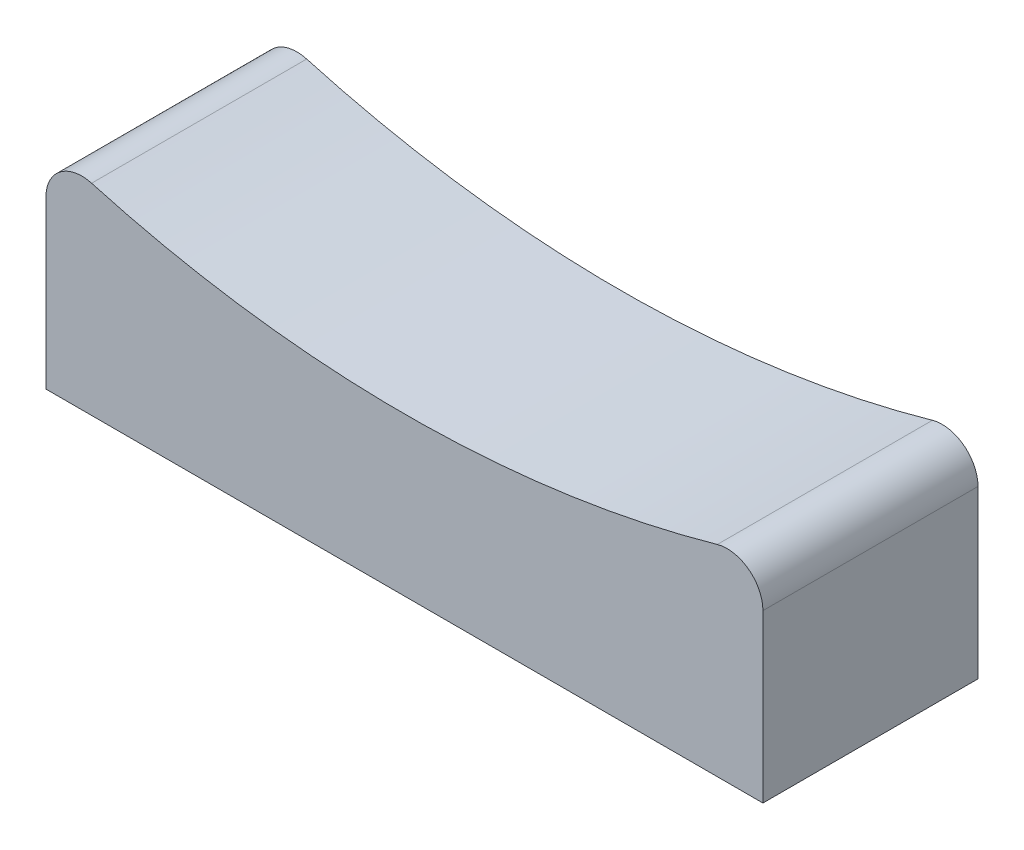
from build123d import *

# Parameters (mm, degrees)
SKETCH1_W           = 100
SKETCH1_H           = 30
BOSS_EXTRUDE1_DEPTH = 20
CUT_EXTRUDE1_DEPTH  = 62.64414003
FILLET1_R           = 5
SKETCH3_W           = 100
SKETCH3_H           = 30
BOSS_EXTRUDE2_DEPTH = 10
SKETCH4_R           = 6
CUT_EXTRUDE2_DEPTH  = 5
SKETCH5_R           = 7.5
CUT_EXTRUDE3_DEPTH  = 4.75
CHAMFER1_SIZE       = 1


with BuildPart() as part:
    # Sketch1 → Boss-Extrude1 (new body)
    with BuildSketch(Plane(origin=(0, 0, 0), x_dir=(1, 0, 0), z_dir=(0, 1, 0))):
        Rectangle(SKETCH1_W, SKETCH1_H)
    extrude(amount=BOSS_EXTRUDE1_DEPTH)

    # Sketch2 → Cut-Extrude1 (cut, through all)
    with BuildSketch(Plane.XY.offset(15)):
        with BuildLine():
            Line((-50, 20), (50, 20))
            ThreePointArc((50, 20), (0, 12), (-50, 20))
        make_face()
    extrude(amount=-CUT_EXTRUDE1_DEPTH, mode=Mode.SUBTRACT)

    # Fillet1
    fillet1_edges = [part.edges().sort_by_distance(p)[0] for p in [
        (-50, 20, 0),
        (50, 20, 0),
    ]]
    fillet(fillet1_edges, radius=FILLET1_R)

    # Sketch3 → Boss-Extrude2 (add)
    with BuildSketch(Plane.XZ):
        Rectangle(SKETCH3_W, SKETCH3_H)
    extrude(amount=BOSS_EXTRUDE2_DEPTH)

    # Sketch4 → Cut-Extrude2 (cut)
    with BuildSketch(Plane.XZ.offset(10)):
        with Locations(Location((0, 0, 0), (0, 0, 270))):
            Circle(SKETCH4_R)
    extrude(amount=-CUT_EXTRUDE2_DEPTH, mode=Mode.SUBTRACT)

    # Sketch5 → Cut-Extrude3 (cut)
    with BuildSketch(Plane.XZ.offset(5)):
        with Locations(Location((0, 0, 0), (0, 0, 270))):
            Circle(SKETCH5_R)
    extrude(amount=-CUT_EXTRUDE3_DEPTH, mode=Mode.SUBTRACT)

    # Chamfer1
    chamfer1_edges = [part.edges().sort_by_distance(p)[0] for p in [
        (0, -10, 6),
    ]]
    chamfer(chamfer1_edges, length=CHAMFER1_SIZE)


solid = part.part
